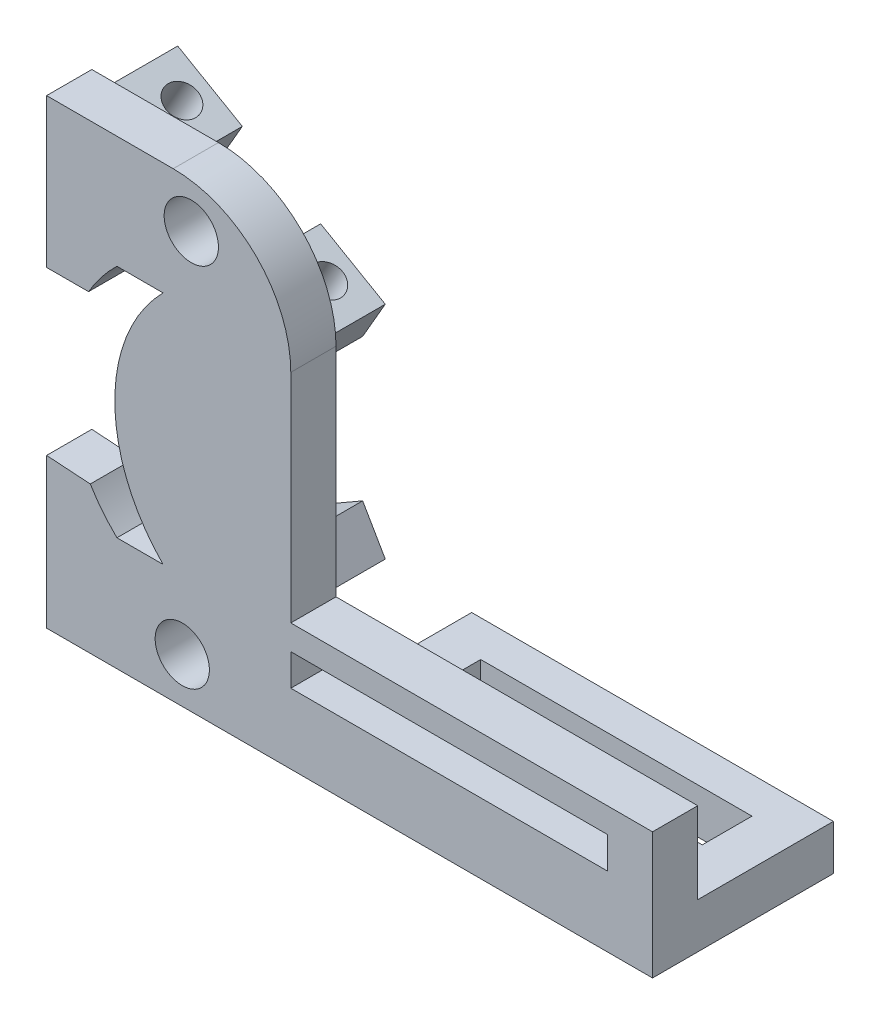
from build123d import *

# Parameters (mm, degrees)
SALIENTE_EXTRUIR1_DEPTH   = 7
SALIENTE_EXTRUIR1_2_DEPTH = 7
CROQUIS2_W                = 27
CROQUIS2_H                = 51
SALIENTE_EXTRUIR2_DEPTH   = 5
CORTAR_EXTRUIR1_REACH     = 48.062
CROQUIS4_R                = 1.75
CORTAR_EXTRUIR2_DEPTH     = 5
CORTAR_EXTRUIR3_REACH     = 46.821
CROQUIS5_R                = 1.75
REDONDEO1_R               = 13
CROQUIS6_W                = 40
CROQUIS6_H                = 20
CROQUIS6_W_2              = 30
CROQUIS6_H_2              = 5.5
SALIENTE_EXTRUIR3_DEPTH   = 5
REDONDEO5_R               = 3
CORTAR_EXTRUIR4_REACH     = 46.821
CROQUIS7_W                = 10
CROQUIS7_H                = 7
CORTAR_EXTRUIR5_REACH     = 58.58
CROQUIS8_W                = 10
CROQUIS8_H                = 7
CORTAR_EXTRUIR6_REACH     = 60.108
CROQUIS10_W               = 5
CROQUIS10_H               = 9
SALIENTE_EXTRUIR4_DEPTH   = 40
CORTAR_EXTRUIR7_REACH     = 60.108
CROQUIS11_W               = 35
CROQUIS11_H               = 3.5
CORTAR_EXTRUIR8_REACH     = 60.108
CROQUIS12_R               = 3


with BuildPart() as part:
    # Croquis1 → Saliente-Extruir1 (new body)
    with BuildSketch(Plane.XY):
        Polygon((0, 0), (-22.9496732, 13.25), (-25.4496732, 8.919872981), (-2.5, -4.330127019), align=None)
    extrude(amount=SALIENTE_EXTRUIR1_DEPTH)



with BuildPart() as body_2:
    # Croquis1 → Saliente-Extruir1 2 (new body)
    with BuildSketch(Plane.XY):
        Polygon((-25.4496732, -33.330127019), (-2.5, -20.080127019), (0, -24.410254038), (-22.9496732, -37.660254038), align=None)
    extrude(amount=SALIENTE_EXTRUIR1_2_DEPTH)


with BuildPart() as part_1:
    add(part.part)

    add(body_2.part)  # Saliente-Extruir2 merges body 2
    # Croquis2 → Saliente-Extruir2 (add)
    with BuildSketch(Plane.XY.offset(7)):
        with Locations((-11.9496732, -12.25)):
            Rectangle(CROQUIS2_W, CROQUIS2_H)
    extrude(amount=SALIENTE_EXTRUIR2_DEPTH)

    # Croquis3 → Cortar-Extruir1 (cut, up to next)
    with BuildSketch(Plane(origin=(0, 0, 7), x_dir=(-1, 0, 0), z_dir=(0, 0, -1)), mode=Mode.PRIVATE) as cortar_extruir1_sk1:
        with BuildLine():
            Line((13.571492094, 0.794872981), (16.671492094, 0.794872981))
            Line((16.671492094, 0.794872981), (17.671492094, 0.794872981))
            ThreePointArc((17.671492094, 0.794872981), (23.221592496, -12.205127019), (17.671492094, -25.205127019))
            Line((17.671492094, -25.205127019), (16.671492094, -25.205127019))
            Line((16.671492094, -25.205127019), (13.571492094, -25.205127019))
            Line((13.571492094, -25.205127019), (12.571492094, -25.205127019))
            ThreePointArc((12.571492094, -25.205127019), (17.909045513, -12.205127019), (12.571492094, 0.794872981))
            Line((12.571492094, 0.794872981), (13.571492094, 0.794872981))
        make_face()
    cortar_extruir1_tool1 = extrude(cortar_extruir1_sk1.sketch, amount=-CORTAR_EXTRUIR1_REACH, mode=Mode.PRIVATE) & part_1.part
    add(cortar_extruir1_tool1.solids().sort_by_distance((-18.892381, -12.205127, 7))[0], mode=Mode.SUBTRACT)

    # Croquis4 → Cortar-Extruir2 (cut)
    with BuildSketch(Plane(origin=(-2.5, -4.330127019, 0), x_dir=(0.8660254037844369, -0.5000000000000031, 0), z_dir=(-0.500000000000003, -0.8660254037844368, 0))):
        with Locations((-22.5, 3)):
            Circle(CROQUIS4_R)
        with Locations((-4, 3)):
            Circle(CROQUIS4_R)
    extrude(amount=-CORTAR_EXTRUIR2_DEPTH, mode=Mode.SUBTRACT)

    # Croquis5 → Cortar-Extruir3 (cut, up to next)
    with BuildSketch(Plane(origin=(8.069950055, -13.977563509, 0), x_dir=(0.8660254037844367, 0.5000000000000033, 0), z_dir=(-0.5000000000000033, 0.8660254037844367, 0)), mode=Mode.PRIVATE) as cortar_extruir3_sk1:
        with Locations(Location((-34.705127019, -3, 0), (0, 0, 180))):
            Circle(CROQUIS5_R)
    cortar_extruir3_tool1 = extrude(cortar_extruir3_sk1.sketch, amount=-CORTAR_EXTRUIR3_REACH, mode=Mode.PRIVATE) & part_1.part
    # Croquis5 → Cortar-Extruir3 (cut, up to next)
    with BuildSketch(Plane(origin=(8.069950055, -13.977563509, 0), x_dir=(0.8660254037844367, 0.5000000000000033, 0), z_dir=(-0.5000000000000033, 0.8660254037844367, 0)), mode=Mode.PRIVATE) as cortar_extruir3_sk2:
        with Locations(Location((-16.205127019, -3, 0), (0, 0, 180))):
            Circle(CROQUIS5_R)
    cortar_extruir3_tool2 = extrude(cortar_extruir3_sk2.sketch, amount=-CORTAR_EXTRUIR3_REACH, mode=Mode.PRIVATE) & part_1.part
    add(cortar_extruir3_tool1.solids().sort_by_distance((-21.985572, -31.330127, 3))[0], mode=Mode.SUBTRACT)
    add(cortar_extruir3_tool2.solids().sort_by_distance((-5.964102, -22.080127, 3))[0], mode=Mode.SUBTRACT)

    # Redondeo1
    redondeo1_edges = [part_1.edges().sort_by_distance(p)[0] for p in [
        (1.5503268, 13.25, 9.5),
    ]]
    fillet(redondeo1_edges, radius=REDONDEO1_R)

    # Croquis6 → Saliente-Extruir3 (add)
    with BuildSketch(Plane.XZ.offset(37.75)):
        with Locations((21.5503268, 2)):
            Rectangle(CROQUIS6_W, CROQUIS6_H)
        with Locations((21.5503268, -1.25)):
            Rectangle(CROQUIS6_W_2, CROQUIS6_H_2, mode=Mode.SUBTRACT)
    extrude(amount=-SALIENTE_EXTRUIR3_DEPTH)

    # Redondeo5
    redondeo5_edges = [part_1.edges().sort_by_distance(p)[0] for p in [
        (1.5503268, -35.25, 7),
    ]]
    fillet(redondeo5_edges, radius=REDONDEO5_R)

    # Croquis7 → Cortar-Extruir4 (cut, up to next)
    with BuildSketch(Plane(origin=(8.069950055, -13.977563509, 0), x_dir=(0.8660254037844367, 0.5000000000000033, 0), z_dir=(-0.5000000000000033, 0.8660254037844367, 0)), mode=Mode.PRIVATE) as cortar_extruir4_sk1:
        with Locations((-25.455127019, -3.5)):
            Rectangle(CROQUIS7_W, CROQUIS7_H)
    cortar_extruir4_tool1 = extrude(cortar_extruir4_sk1.sketch, amount=-CORTAR_EXTRUIR4_REACH, mode=Mode.PRIVATE) & part_1.part
    add(cortar_extruir4_tool1.solids().sort_by_distance((-13.974837, -26.705127, 3.5))[0], mode=Mode.SUBTRACT)

    # Croquis8 → Cortar-Extruir5 (cut, up to next)
    with BuildSketch(Plane(origin=(-2.5, -4.330127019, 0), x_dir=(0.8660254037844369, -0.5000000000000031, 0), z_dir=(-0.500000000000003, -0.8660254037844368, 0)), mode=Mode.PRIVATE) as cortar_extruir5_sk1:
        with Locations((-13.25, 3.5)):
            Rectangle(CROQUIS8_W, CROQUIS8_H)
    cortar_extruir5_tool1 = extrude(cortar_extruir5_sk1.sketch, amount=-CORTAR_EXTRUIR5_REACH, mode=Mode.PRIVATE) & part_1.part
    add(cortar_extruir5_tool1.solids().sort_by_distance((-13.974837, 2.294873, 3.5))[0], mode=Mode.SUBTRACT)

    # Croquis9 → Cortar-Extruir6 (cut, up to next)
    with BuildSketch(Plane(origin=(0, 0, 7), x_dir=(-1, 0, 0), z_dir=(0, 0, -1)), mode=Mode.PRIVATE) as cortar_extruir6_sk1:
        with BuildLine():
            Line((25.4496732, -3.205127019), (25.4496732, -21.205127019))
            Line((25.4496732, -21.205127019), (20.619740445, -21.526985187))
            ThreePointArc((20.619740445, -21.526985187), (23.220621564, -12.392083108), (20.810049764, -3.205127019))
            Line((20.810049764, -3.205127019), (25.4496732, -3.205127019))
        make_face()
    cortar_extruir6_tool1 = extrude(cortar_extruir6_sk1.sketch, amount=-CORTAR_EXTRUIR6_REACH, mode=Mode.PRIVATE) & part_1.part
    add(cortar_extruir6_tool1.solids().sort_by_distance((-23.839782, -12.328925, 7))[0], mode=Mode.SUBTRACT)

    # Croquis10 → Saliente-Extruir4 (add)
    with BuildSketch(Plane(origin=(1.5503268, 0, 0), x_dir=(0, 0, -1), z_dir=(1, 0, 0))):
        with Locations((-9.5, -28.25)):
            Rectangle(CROQUIS10_W, CROQUIS10_H)
    extrude(amount=SALIENTE_EXTRUIR4_DEPTH)

    # Croquis11 → Cortar-Extruir7 (cut, up to next)
    with BuildSketch(Plane(origin=(0, 0, 7), x_dir=(-1, 0, 0), z_dir=(0, 0, -1)), mode=Mode.PRIVATE) as cortar_extruir7_sk1:
        with Locations((-19.0503268, -28.25)):
            Rectangle(CROQUIS11_W, CROQUIS11_H)
    cortar_extruir7_tool1 = extrude(cortar_extruir7_sk1.sketch, amount=-CORTAR_EXTRUIR7_REACH, mode=Mode.PRIVATE) & part_1.part
    add(cortar_extruir7_tool1.solids().sort_by_distance((19.050327, -28.25, 7))[0], mode=Mode.SUBTRACT)

    # Croquis12 → Cortar-Extruir8 (cut, up to next)
    with BuildSketch(Plane(origin=(0, 0, 7), x_dir=(-1, 0, 0), z_dir=(0, 0, -1)), mode=Mode.PRIVATE) as cortar_extruir8_sk1:
        with Locations((10.4496732, -32.75)):
            Circle(CROQUIS12_R)
    cortar_extruir8_tool1 = extrude(cortar_extruir8_sk1.sketch, amount=-CORTAR_EXTRUIR8_REACH, mode=Mode.PRIVATE) & part_1.part
    # Croquis12 → Cortar-Extruir8 (cut, up to next)
    with BuildSketch(Plane(origin=(0, 0, 7), x_dir=(-1, 0, 0), z_dir=(0, 0, -1)), mode=Mode.PRIVATE) as cortar_extruir8_sk2:
        with Locations(Location((9.4496732, 8.25, 0), (0, 0, 180))):
            Circle(CROQUIS12_R)
    cortar_extruir8_tool2 = extrude(cortar_extruir8_sk2.sketch, amount=-CORTAR_EXTRUIR8_REACH, mode=Mode.PRIVATE) & part_1.part
    add(cortar_extruir8_tool1.solids().sort_by_distance((-10.449673, -32.75, 7))[0], mode=Mode.SUBTRACT)
    add(cortar_extruir8_tool2.solids().sort_by_distance((-9.449673, 8.25, 7))[0], mode=Mode.SUBTRACT)


solid = part_1.part
